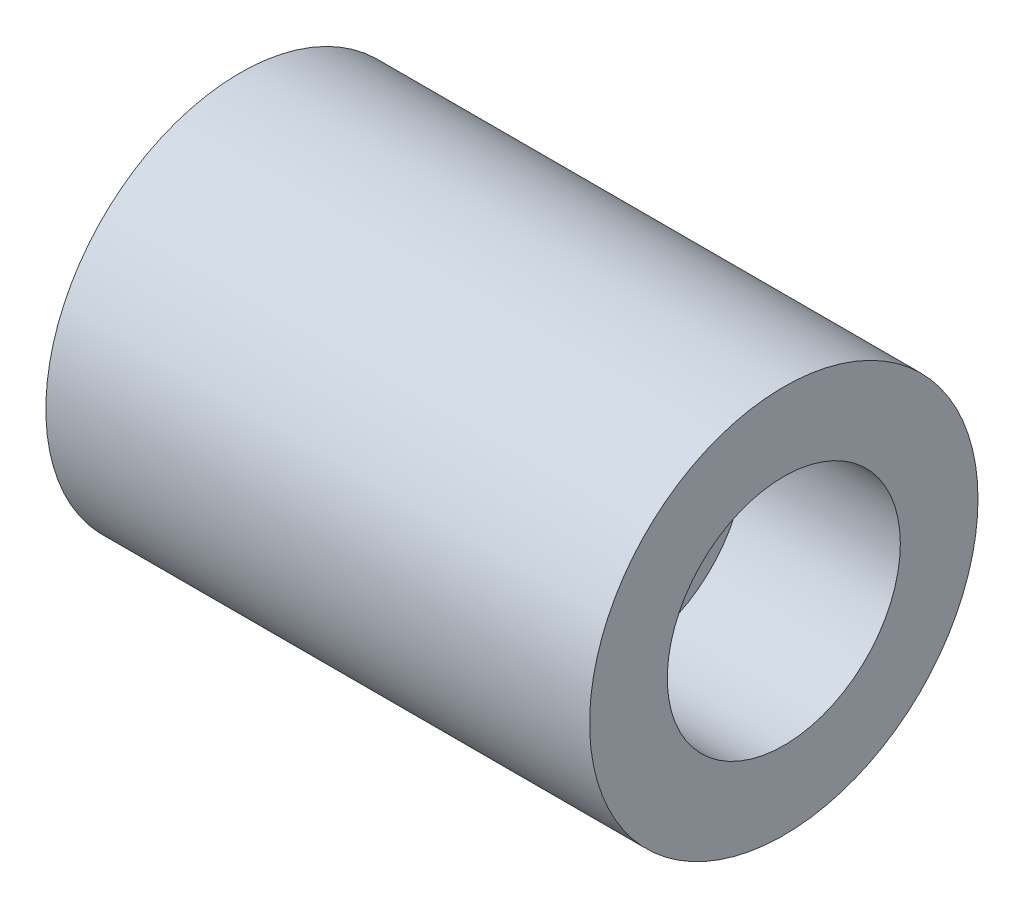
from build123d import *


with BuildPart() as part:
    # Croquis1 → Revolución1 (revolve)
    with BuildSketch(Plane.XY, mode=Mode.PRIVATE) as revoluci_n1_sk:
        Polygon((0, 0), (0, 50), (140, 50), (140, 30), (100, 30), (100, 10), (20, 10), (20, 0), align=None)
    revolve(revoluci_n1_sk.sketch.rotate(Axis((20, 0, 0), (-1, 0, 0)), 90), axis=Axis((20, 0, 0), (-1, 0, 0)))


solid = part.part
